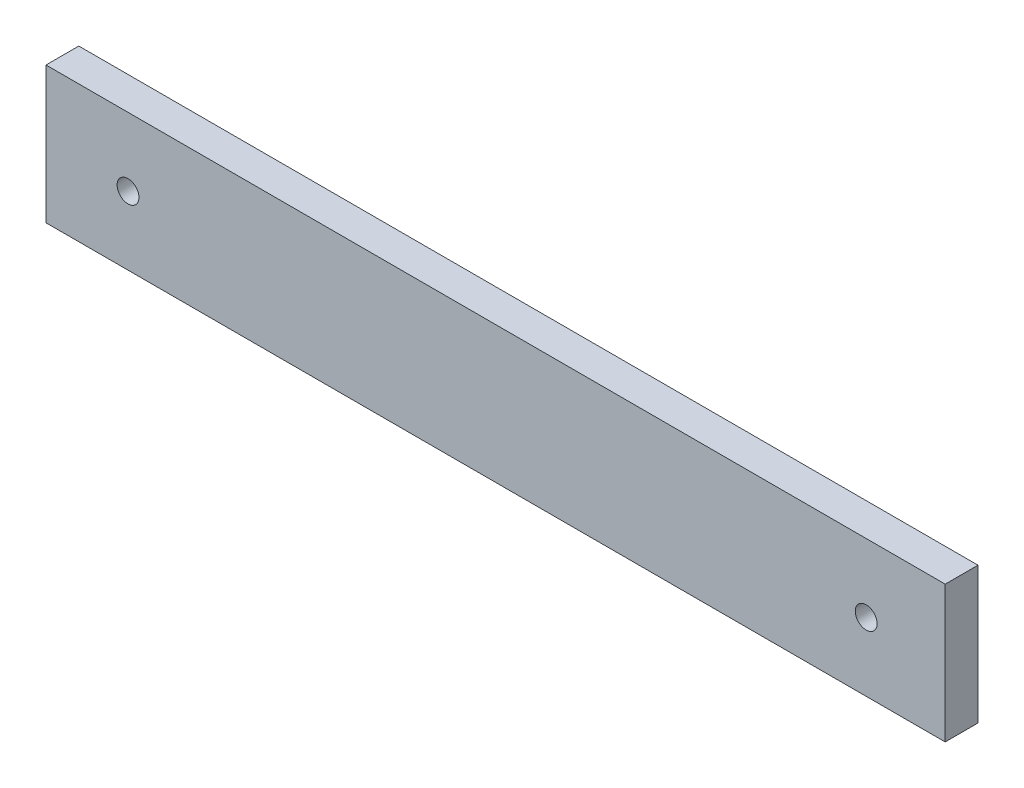
from build123d import *

# Parameters (mm, degrees)
SKETCH1_W           = 164.449026406
SKETCH1_H           = 25
SKETCH1_R           = 2
BOSS_EXTRUDE1_DEPTH = 6


with BuildPart() as part:
    # Sketch1 → Boss-Extrude1 (new body)
    with BuildSketch(Plane(origin=(0, 0, 0), x_dir=(-1, 0, 0), z_dir=(0, 0, 1))):
        with Locations((52.775486797, 10)):
            Rectangle(SKETCH1_W, SKETCH1_H)
        with Locations(Location((-15, 10, 0), (0, 0, 180))):
            Circle(SKETCH1_R, mode=Mode.SUBTRACT)
        with Locations(Location((120, 10, 0), (0, 0, 180))):
            Circle(SKETCH1_R, mode=Mode.SUBTRACT)
    extrude(amount=BOSS_EXTRUDE1_DEPTH)


solid = part.part
